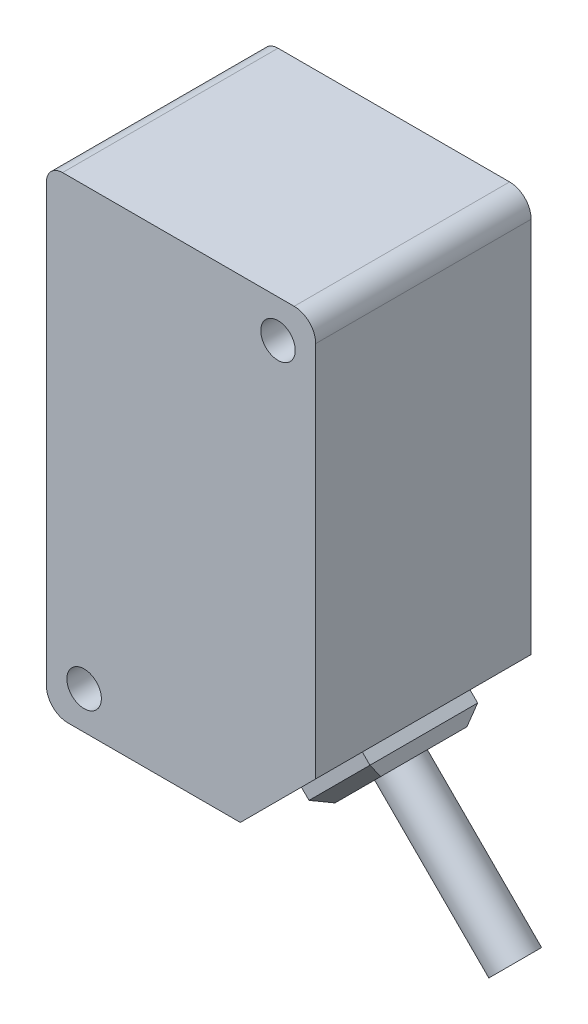
from build123d import *

# Parameters (mm, degrees)
SKETCH_1_R          = 1.6
EXTRUDE_1_DEPTH     = 20
SKETCH_2_R          = 1.6
CUT_EXTRUDE_1_DEPTH = 1
FILLET_1_R          = 1.5
FILLET_2_R          = 2
SKETCH_3_W          = 10
SKETCH_3_H          = 8
EXTRUDE_2_DEPTH     = 2
CHAMFER_1_SIZE      = 1
SKETCH_4_R          = 2
EXTRUDE_3_DEPTH     = 15


with BuildPart() as part:
    # 草图1 → 凸台-拉伸1 (new body)
    with BuildSketch(Plane.XY):
        Polygon((0, 0), (0, 44), (25, 44), (25, 7), (18, 0), align=None)
        with Locations((21.5, 40.5)):
            Circle(SKETCH_1_R, mode=Mode.SUBTRACT)
        with Locations((3.5, 3.5)):
            Circle(SKETCH_1_R, mode=Mode.SUBTRACT)
    extrude(amount=EXTRUDE_1_DEPTH)

    # 草图2 → 切除-拉伸1 (cut)
    with BuildSketch(Plane.ZY):
        with Locations(Location((10, 37.7, 0), (0, 0, 270))):
            Circle(SKETCH_2_R)
    extrude(amount=-CUT_EXTRUDE_1_DEPTH, mode=Mode.SUBTRACT)

    # 圆角1
    fillet_1_edges = [part.edges().sort_by_distance(p)[0] for p in [
        (0, 44, 10),
    ]]
    fillet(fillet_1_edges, radius=FILLET_1_R)

    # 圆角2
    fillet_2_edges = [part.edges().sort_by_distance(p)[0] for p in [
        (0, 0, 10),
        (25, 44, 10),
    ]]
    fillet(fillet_2_edges, radius=FILLET_2_R)

    # 草图3 → 凸台-拉伸2 (add)
    with BuildSketch(Plane(origin=(9, -9, 0), x_dir=(0, 0, -1), z_dir=(0.7071067811865487, -0.7071067811865464, 0))):
        with Locations((-10, 17.67766953)):
            Rectangle(SKETCH_3_W, SKETCH_3_H)
    extrude(amount=EXTRUDE_2_DEPTH)

    # 倒角1
    chamfer_1_edges = [part.edges().sort_by_distance(p)[0] for p in [
        (22.914213562, 2.085786438, 5),
        (25.742640687, 4.914213562, 10),
        (22.914213562, 2.085786438, 15),
        (20.085786438, -0.742640687, 10),
    ]]
    chamfer(chamfer_1_edges, length=CHAMFER_1_SIZE)

    # 草图4 → 凸台-拉伸3 (add)
    with BuildSketch(Plane(origin=(10.414213562, -10.414213562, 0), x_dir=(0, 0, -1), z_dir=(0.7071067811865485, -0.7071067811865467, 0))):
        with Locations(Location((-10, 17.67766953, 0), (0, 0, 90))):
            Circle(SKETCH_4_R)
    extrude(amount=EXTRUDE_3_DEPTH)


solid = part.part
